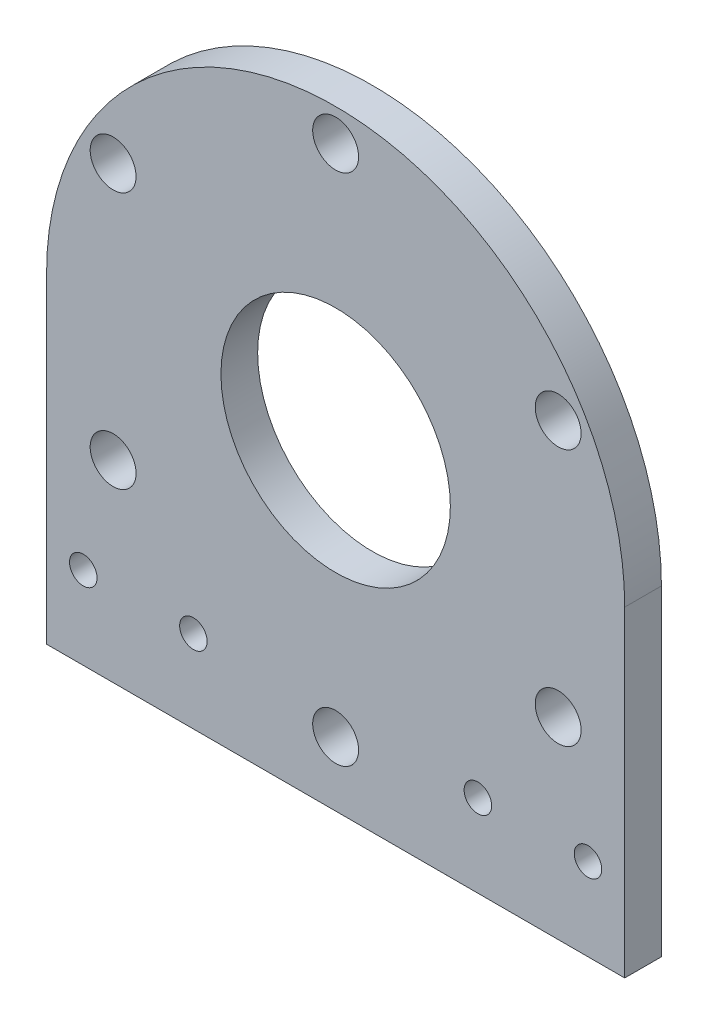
from build123d import *

# Parameters (mm, degrees)
SKETCH_1_R          = 31.5
EXTRUDE_1_DEPTH     = 4
SKETCH_2_R          = 12.5
SKETCH_2_R_2        = 2.5
CUT_EXTRUDE_1_DEPTH = 48.257274572
SKETCH_3_R          = 1.5
CUT_EXTRUDE_2_DEPTH = 48.257274572


with BuildPart() as part:
    # 草图1 → 凸台-拉伸1 (new body)
    with BuildSketch(Plane.XY):
        Circle(SKETCH_1_R)
        with BuildLine():
            ThreePointArc((31.5, 0), (0, -31.5), (-31.5, 0))
            Line((-31.5, 0), (-31.5, -35))
            Line((-31.5, -35), (31.5, -35))
            Line((31.5, -35), (31.5, 0))
        make_face()
    extrude(amount=EXTRUDE_1_DEPTH)

    # 草图2 → 切除-拉伸1 (cut, through all)
    with BuildSketch(Plane.XY.offset(4)):
        Circle(SKETCH_2_R)
        with Locations((0, 28)):
            Circle(SKETCH_2_R_2)
        with Locations((24.248711306, -14)):
            Circle(SKETCH_2_R_2)
        with Locations((-24.248711306, -14)):
            Circle(SKETCH_2_R_2)
        with Locations((0, -28)):
            Circle(SKETCH_2_R_2)
        with Locations((-24.248711306, 14)):
            Circle(SKETCH_2_R_2)
        with Locations((24.248711306, 14)):
            Circle(SKETCH_2_R_2)
    extrude(amount=-CUT_EXTRUDE_1_DEPTH, mode=Mode.SUBTRACT)

    # 草图3 → 切除-拉伸2 (cut, through all)
    with BuildSketch(Plane.XY.offset(4)):
        with Locations((-27.5, -26)):
            Circle(SKETCH_3_R)
        with Locations((-15.5, -26)):
            Circle(SKETCH_3_R)
        with Locations(Location((15.5, -26, 0), (0, 0, 180))):
            Circle(SKETCH_3_R)
        with Locations(Location((27.5, -26, 0), (0, 0, 180))):
            Circle(SKETCH_3_R)
    extrude(amount=-CUT_EXTRUDE_2_DEPTH, mode=Mode.SUBTRACT)


solid = part.part
